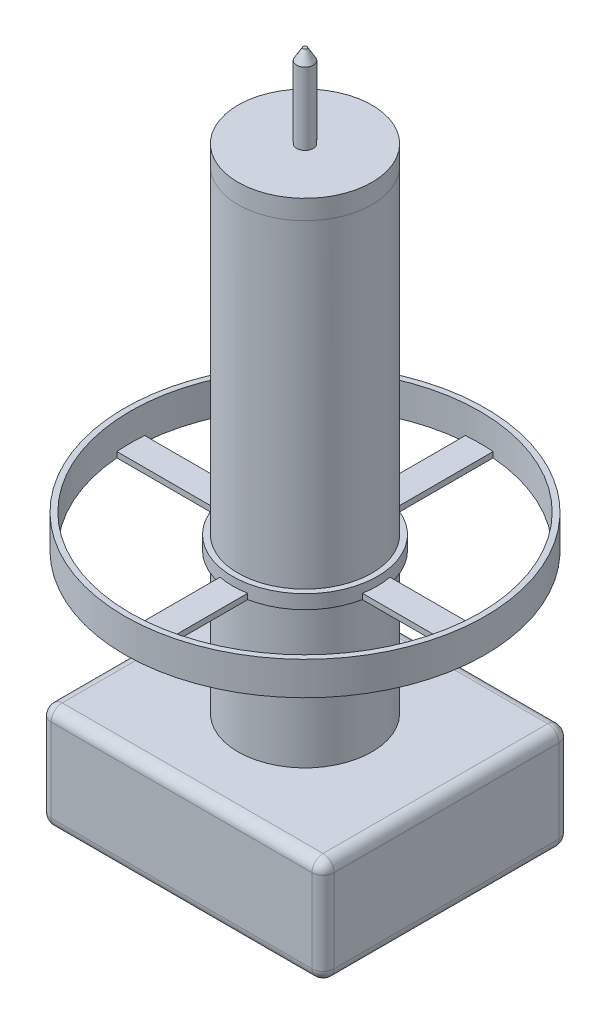
from build123d import *

# Parameters (mm, degrees)
SKETCH2_W           = 102
SKETCH2_H           = 89
BOSS_EXTRUDE1_DEPTH = 38
SKETCH3_R           = 24.13
BOSS_EXTRUDE2_DEPTH = 177.8
BOSS_EXTRUDE3_START = 50.8
SKETCH4_R           = 65
SKETCH4_R_2         = 63
BOSS_EXTRUDE3_DEPTH = 12
BOSS_EXTRUDE4_DEPTH = 2
SKETCH7_R           = 26.13
SKETCH7_R_2         = 24.13
BOSS_EXTRUDE6_DEPTH = 5
SKETCH6_R           = 3
BOSS_EXTRUDE5_DEPTH = 30
CHAMFER1_SIZE       = 4
CHAMFER1_SIZE2      = 2.309401077
FILLET1_R           = 4


with BuildPart() as part:
    # Sketch2 → Boss-Extrude1 (new body)
    with BuildSketch(Plane(origin=(0, 0, 0), x_dir=(1, 0, 0), z_dir=(0, 1, 0))):
        with Locations((6.5, 0)):
            Rectangle(SKETCH2_W, SKETCH2_H)
    extrude(amount=BOSS_EXTRUDE1_DEPTH)

    # Sketch3 → Boss-Extrude2 (add)
    with BuildSketch(Plane(origin=(0, 38, 0), x_dir=(1, 0, 0), z_dir=(0, 1, 0))):
        with Locations(Location((6.5, 0, 0), (0, 0, 270))):
            Circle(SKETCH3_R)
    extrude(amount=BOSS_EXTRUDE2_DEPTH)

    # Sketch5 → Boss-Extrude4 (add)
    with BuildSketch(Plane.XZ.offset(-88.8)):
        with BuildLine():
            Line((1.5, 23.606289416), (1.5, 62.801273872))
            ThreePointArc((1.5, 62.801273872), (6.5, 63), (11.5, 62.801273872))
            Line((11.5, 62.801273872), (11.5, 23.606289416))
            ThreePointArc((11.5, 23.606289416), (6.5, 24.13), (1.5, 23.606289416))
        make_face()
        with BuildLine():
            Line((69.301273872, -5), (30.106289416, -5))
            ThreePointArc((30.106289416, -5), (30.63, 0), (30.106289416, 5))
            Line((30.106289416, 5), (69.301273872, 5))
            ThreePointArc((69.301273872, 5), (69.5, 0), (69.301273872, -5))
        make_face()
        with BuildLine():
            Line((1.5, -62.801273872), (1.5, -23.606289416))
            ThreePointArc((1.5, -23.606289416), (6.5, -24.13), (11.5, -23.606289416))
            Line((11.5, -23.606289416), (11.5, -62.801273872))
            ThreePointArc((11.5, -62.801273872), (6.5, -63), (1.5, -62.801273872))
        make_face()
        with BuildLine():
            Line((-56.301273872, 5), (-17.106289416, 5))
            ThreePointArc((-17.106289416, 5), (-17.63, 0), (-17.106289416, -5))
            Line((-17.106289416, -5), (-56.301273872, -5))
            ThreePointArc((-56.301273872, -5), (-56.5, 0), (-56.301273872, 5))
        make_face()
    extrude(amount=-BOSS_EXTRUDE4_DEPTH)


with BuildPart() as body_2:
    # Sketch4 → Boss-Extrude3 (new body)
    with BuildSketch(Plane(origin=(0, 38, 0), x_dir=(1, 0, 0), z_dir=(0, 1, 0)).offset(BOSS_EXTRUDE3_START)):
        with Locations(Location((6.5, 0, 0), (0, 0, 270))):
            Circle(SKETCH4_R)
        with Locations(Location((6.5, 0, 0), (0, 0, 270))):
            Circle(SKETCH4_R_2, mode=Mode.SUBTRACT)
    extrude(amount=BOSS_EXTRUDE3_DEPTH)


    add(part.part)  # Boss-Extrude6 merges part
    # Sketch7 → Boss-Extrude6 (add)
    with BuildSketch(Plane.XZ.offset(-88.8)):
        with Locations(Location((6.5, 0, 0), (0, 0, 270))):
            Circle(SKETCH7_R)
        with Locations(Location((6.5, 0, 0), (0, 0, 90))):
            Circle(SKETCH7_R_2, mode=Mode.SUBTRACT)
    extrude(amount=-BOSS_EXTRUDE6_DEPTH)

    # Sketch6 → Boss-Extrude5 (add)
    with BuildSketch(Plane(origin=(0, 215.8, 0), x_dir=(1, 0, 0), z_dir=(0, 1, 0))):
        with Locations(Location((6.5, 0, 0), (0, 0, 270))):
            Circle(SKETCH6_R)
    extrude(amount=BOSS_EXTRUDE5_DEPTH)

    # Chamfer1
    chamfer1_edges = [body_2.edges().sort_by_distance(p)[0] for p in [
        (6.5, 245.8, -3),
    ]]
    chamfer1_side = [body_2.faces().sort_by_distance(p)[0] for p in [
        (6.5, 230.8, -3),
    ]]
    chamfer(chamfer1_edges, length=CHAMFER1_SIZE, length2=CHAMFER1_SIZE2, reference=chamfer1_side[0])

    # Fillet1
    fillet1_edges = [body_2.edges().sort_by_distance(p)[0] for p in [
        (-44.5, 0, 0),
        (-44.5, 19, -44.5),
        (6.5, 0, 44.5),
        (-44.5, 19, 44.5),
        (57.5, 0, 0),
        (57.5, 19, 44.5),
        (6.5, 0, -44.5),
        (57.5, 19, -44.5),
        (-44.5, 38, 0),
        (6.5, 38, 44.5),
        (57.5, 38, 0),
        (6.5, 38, -44.5),
    ]]
    fillet(fillet1_edges, radius=FILLET1_R)


solid = body_2.part
